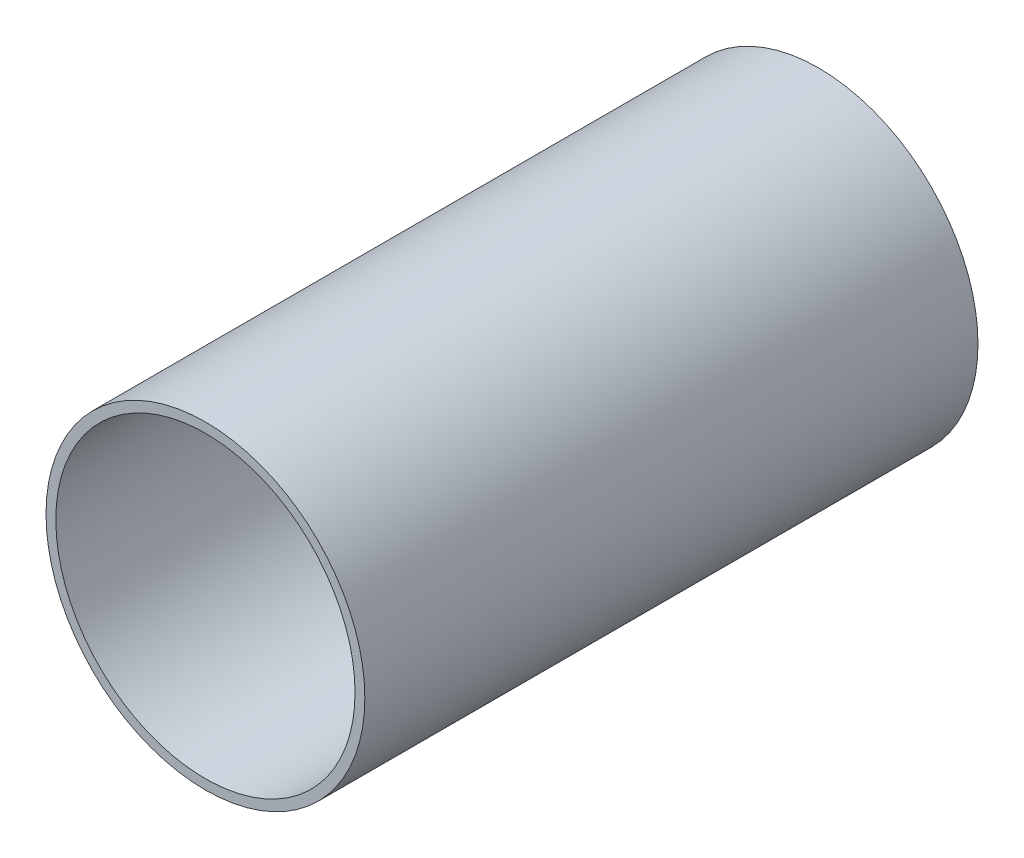
from build123d import *

# Parameters (mm, degrees)
SKETCH1_R           = 65
SKETCH1_R_2         = 61
BOSS_EXTRUDE1_DEPTH = 250


with BuildPart() as part:
    # Sketch1 → Boss-Extrude1 (new body)
    with BuildSketch(Plane.XY):
        Circle(SKETCH1_R)
        Circle(SKETCH1_R_2, mode=Mode.SUBTRACT)
    extrude(amount=BOSS_EXTRUDE1_DEPTH)


solid = part.part
